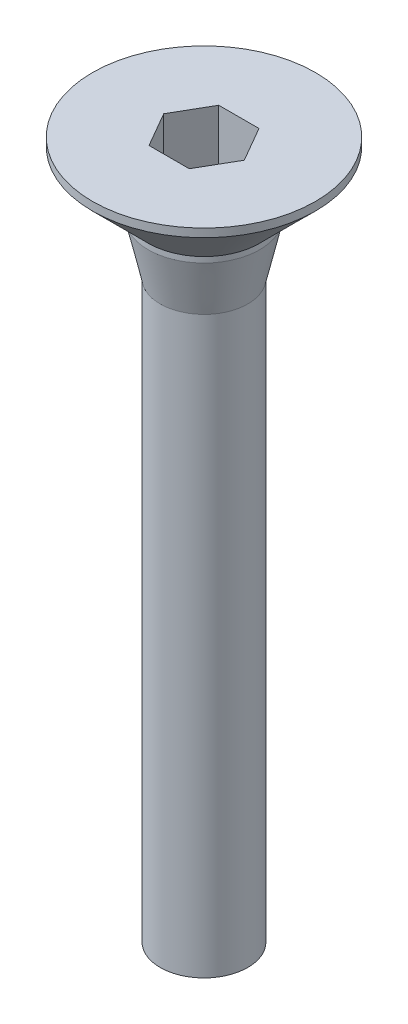
from build123d import *

# Parameters (mm, degrees)
SCHNITT_LINEAR_AUSTRAGEN1_DEPTH = 5.3


with BuildPart() as part:
    # Skizze1 → Basis-Rotation (revolve)
    with BuildSketch(Plane.XY, mode=Mode.PRIVATE) as basis_rotation_sk:
        Polygon((0, 0), (4, 0), (4, -0.3), (2, -2.3), (2, -2.5), (1.5705, -4.4), (1.5705, -25), (0, -25), align=None)
    revolve(basis_rotation_sk.sketch.rotate(Axis((0, 0, 0), (0, -1, 0)), 180), axis=Axis((0, 0, 0), (0, -1, 0)))

    # Skizze2 → Schnitt-Linear austragen1 (cut)
    with BuildSketch(Plane(origin=(0, 0, 0), x_dir=(-1, 0, 0), z_dir=(0, 1, 0))):
        Polygon((0.721687836, -1.25), (-0.721687836, -1.25), (-1.443375673, 0), (-0.721687836, 1.25), (0.721687836, 1.25), (1.443375673, 0), align=None)
    extrude(amount=-SCHNITT_LINEAR_AUSTRAGEN1_DEPTH, mode=Mode.SUBTRACT)


solid = part.part
